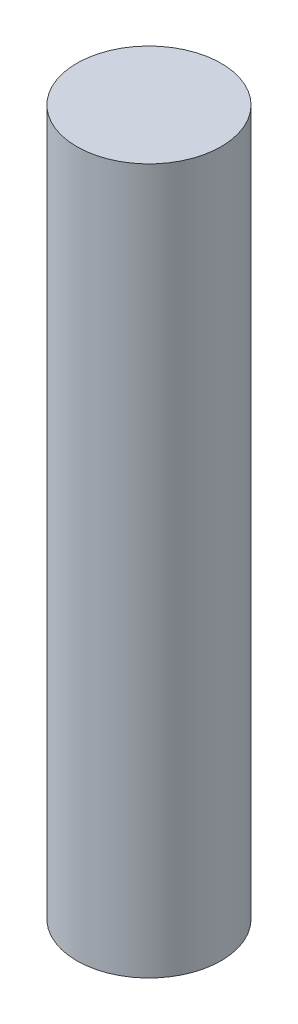
from build123d import *

# Parameters (mm, degrees)
SKETCH1_R           = 3.175
BOSS_EXTRUDE1_DEPTH = 31


with BuildPart() as part:
    # Sketch1 → Boss-Extrude1 (new body)
    with BuildSketch(Plane(origin=(0, 0, 0), x_dir=(1, 0, 0), z_dir=(0, 1, 0))):
        with Locations(Location((0, 0, 0), (0, 0, 270))):
            Circle(SKETCH1_R)
    extrude(amount=BOSS_EXTRUDE1_DEPTH)


solid = part.part
